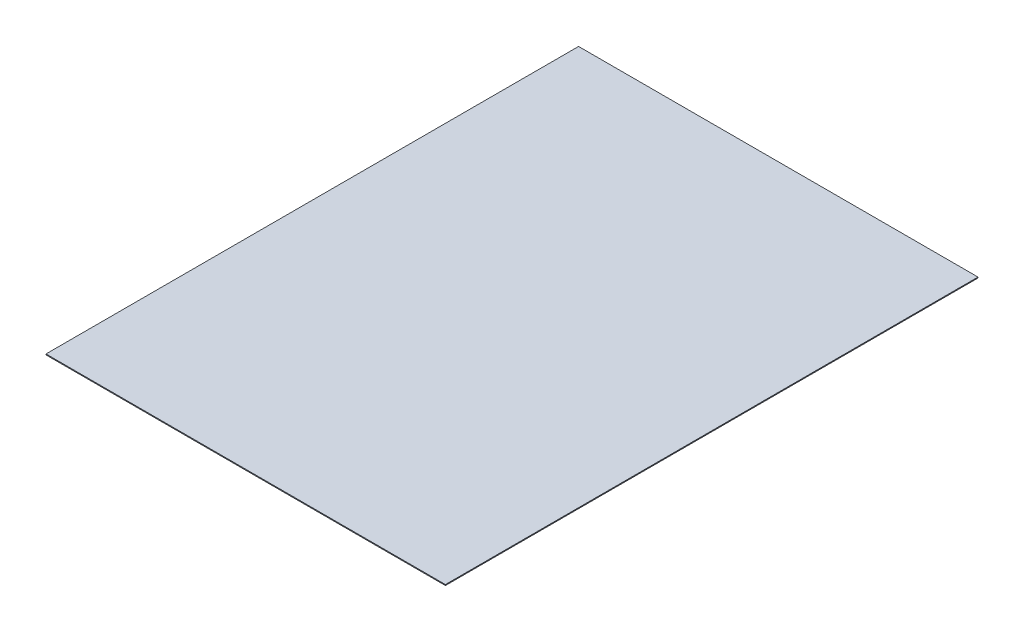
from build123d import *

# Parameters (mm, degrees)
SKETCH1_W           = 900
SKETCH1_H           = 1200
BOSS_EXTRUDE1_DEPTH = 2


with BuildPart() as part:
    # Sketch1 → Boss-Extrude1 (new body)
    with BuildSketch(Plane(origin=(0, 0, 0), x_dir=(1, 0, 0), z_dir=(0, 1, 0))):
        with Locations((405.604338843, -569.411157025)):
            Rectangle(SKETCH1_W, SKETCH1_H)
    extrude(amount=BOSS_EXTRUDE1_DEPTH)


solid = part.part
